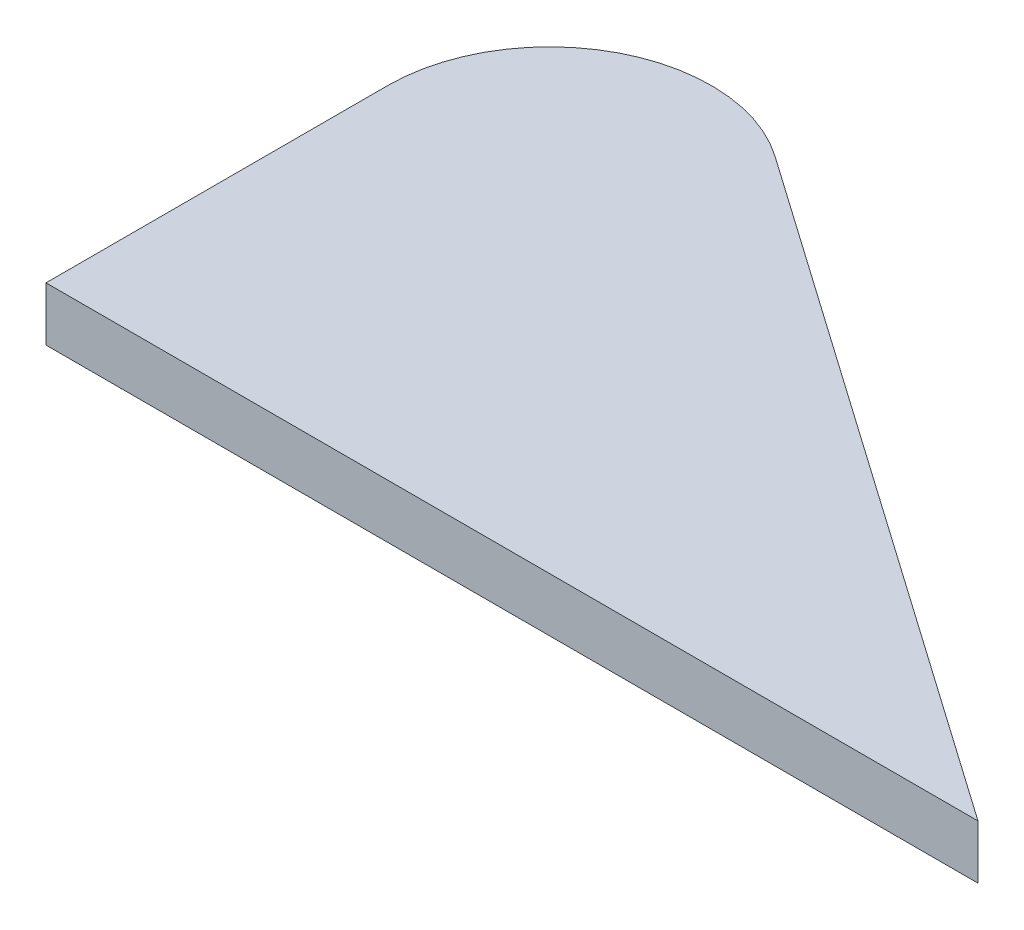
from build123d import *

# Parameters (mm, degrees)
BOSS_EXTRUDE2_DEPTH = 6.35


with BuildPart() as part:
    # Sketch1 → Boss-Extrude2 (new body)
    with BuildSketch(Plane(origin=(0, 0, 0), x_dir=(1, 0, 0), z_dir=(0, 1, 0))):
        with BuildLine():
            Line((19.05, 0), (109.737398428, 0))
            Line((109.737398428, 0), (29.976631112, 55.849090528))
            ThreePointArc((29.976631112, 55.849090528), (10.253688918, 57.141800456), (0, 40.244244084))
            Line((0, 40.244244084), (0, 0))
            Line((0, 0), (19.05, 0))
        make_face()
    extrude(amount=BOSS_EXTRUDE2_DEPTH)


solid = part.part
